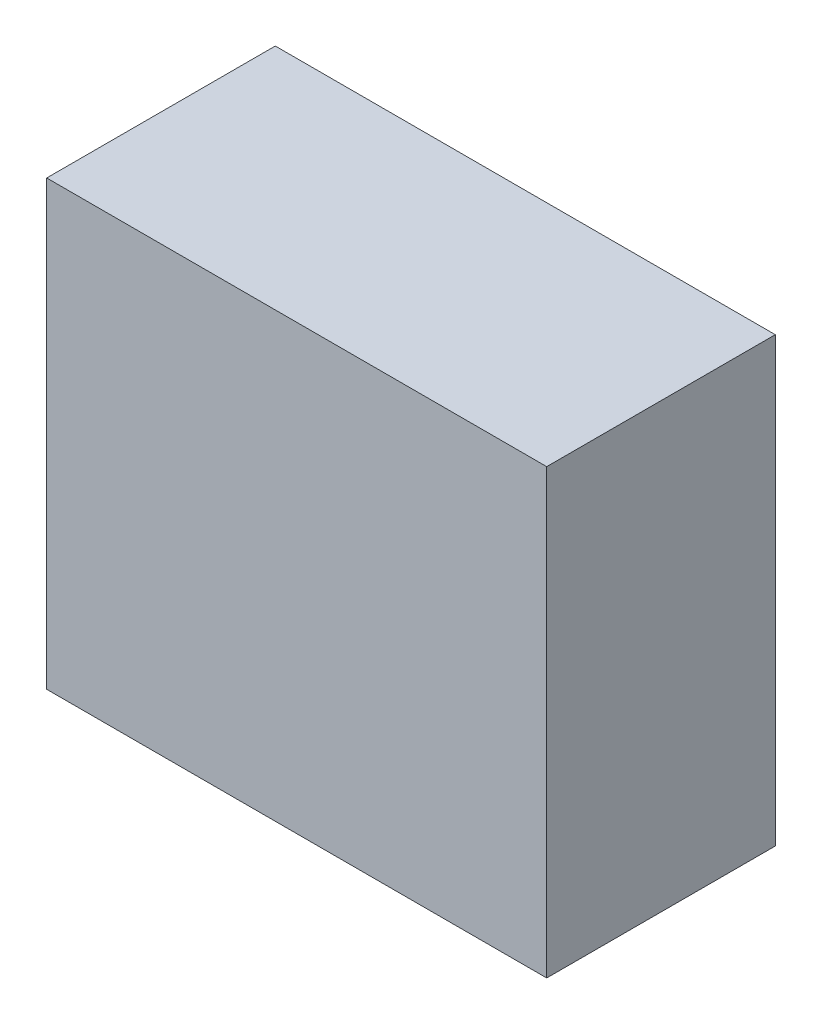
from build123d import *

# Parameters (mm, degrees)
SKETCH1_W           = 70
SKETCH1_H           = 62
BOSS_EXTRUDE1_DEPTH = 32


with BuildPart() as part:
    # Sketch1 → Boss-Extrude1 (new body)
    with BuildSketch(Plane.XY):
        with Locations((-13.219913232, -9.219913232)):
            Rectangle(SKETCH1_W, SKETCH1_H)
    extrude(amount=BOSS_EXTRUDE1_DEPTH)


solid = part.part
